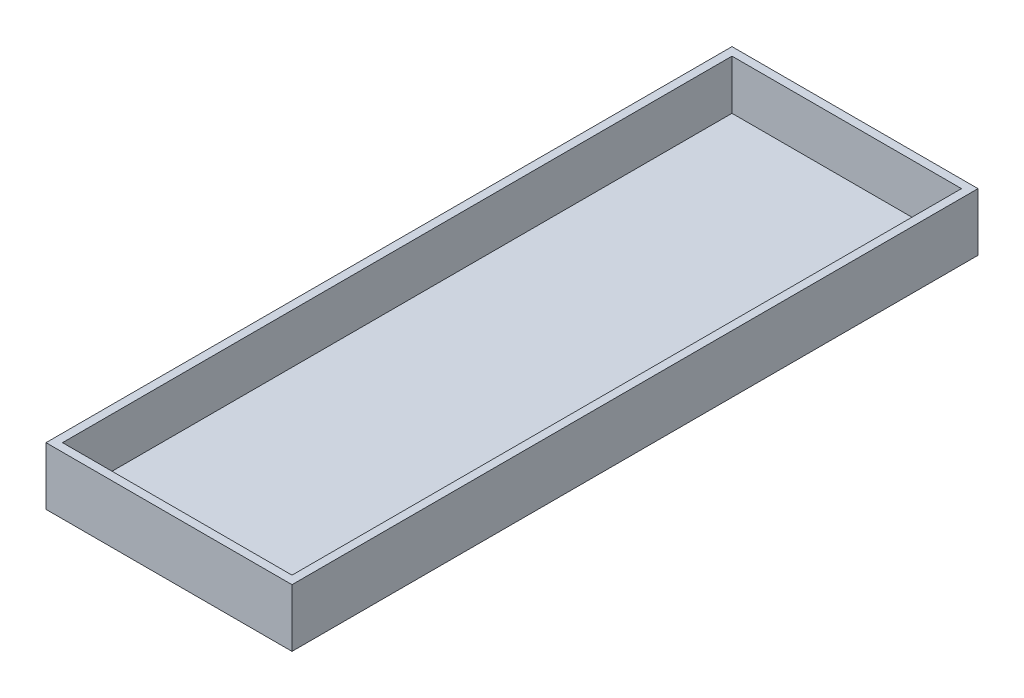
from build123d import *

# Parameters (mm, degrees)
SKETCH1_W           = 59.6
SKETCH1_H           = 14
BOSS_EXTRUDE1_DEPTH = 166.2
SKETCH5_W           = 55.6
SKETCH5_H           = 162.2
CUT_EXTRUDE2_DEPTH  = 12


with BuildPart() as part:
    # Sketch1 → Boss-Extrude1 (new body)
    with BuildSketch(Plane.XY):
        with Locations((-108.016055239, 28.210276543)):
            Rectangle(SKETCH1_W, SKETCH1_H)
    extrude(amount=BOSS_EXTRUDE1_DEPTH)

    # Sketch5 → Cut-Extrude2 (cut)
    with BuildSketch(Plane(origin=(0, 35.210276543, 0), x_dir=(1, 0, 0), z_dir=(0, 1, 0))):
        with Locations((-108.016055239, -83.1)):
            Rectangle(SKETCH5_W, SKETCH5_H)
    extrude(amount=-CUT_EXTRUDE2_DEPTH, mode=Mode.SUBTRACT)


solid = part.part
